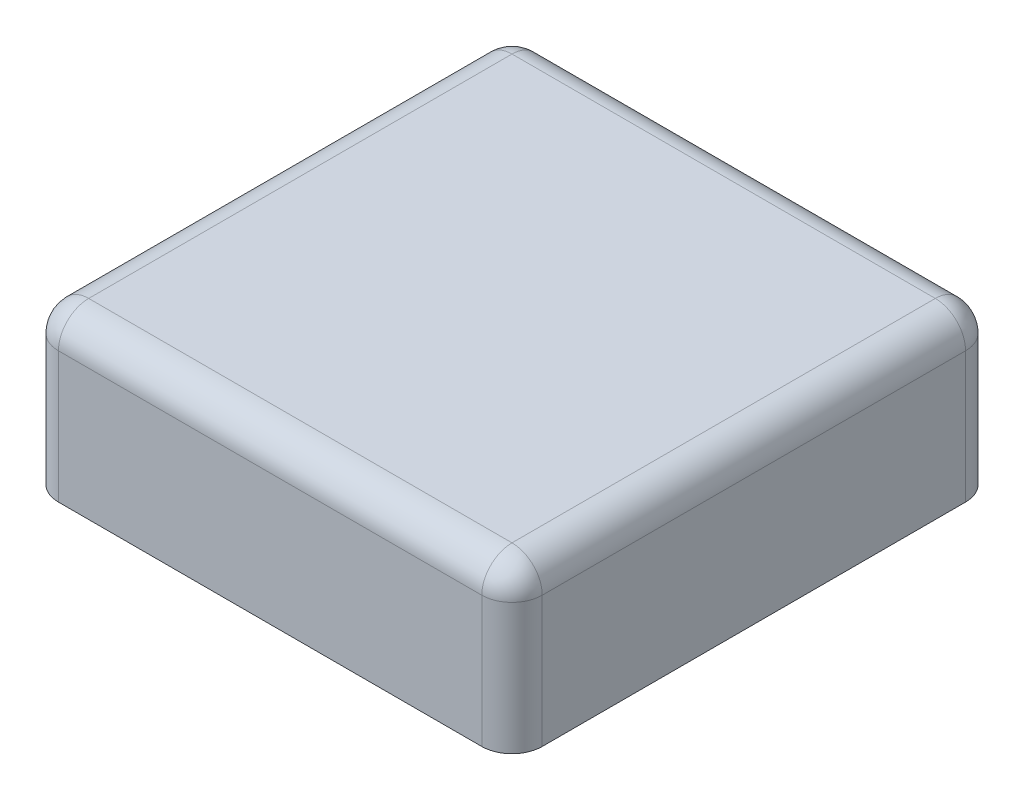
from build123d import *

# Parameters (mm, degrees)
SKETCH1_W           = 12
SKETCH1_H           = 12
BOSS_EXTRUDE1_DEPTH = 4
FILLET1_R           = 0.75


with BuildPart() as part:
    # Sketch1 → Boss-Extrude1 (new body)
    with BuildSketch(Plane(origin=(0, 0, 0), x_dir=(1, 0, 0), z_dir=(0, 1, 0))):
        with Locations((-4.134154876, 4.295100408)):
            Rectangle(SKETCH1_W, SKETCH1_H)
    extrude(amount=BOSS_EXTRUDE1_DEPTH)

    # Fillet1
    fillet1_edges = [part.edges().sort_by_distance(p)[0] for p in [
        (1.865845124, 4, -4.295100408),
        (-4.134154876, 4, -10.295100408),
        (-10.134154876, 4, -4.295100408),
        (-4.134154876, 4, 1.704899592),
        (-10.134154876, 2, -10.295100408),
        (1.865845124, 2, -10.295100408),
        (1.865845124, 2, 1.704899592),
        (-10.134154876, 2, 1.704899592),
    ]]
    fillet(fillet1_edges, radius=FILLET1_R)


solid = part.part
